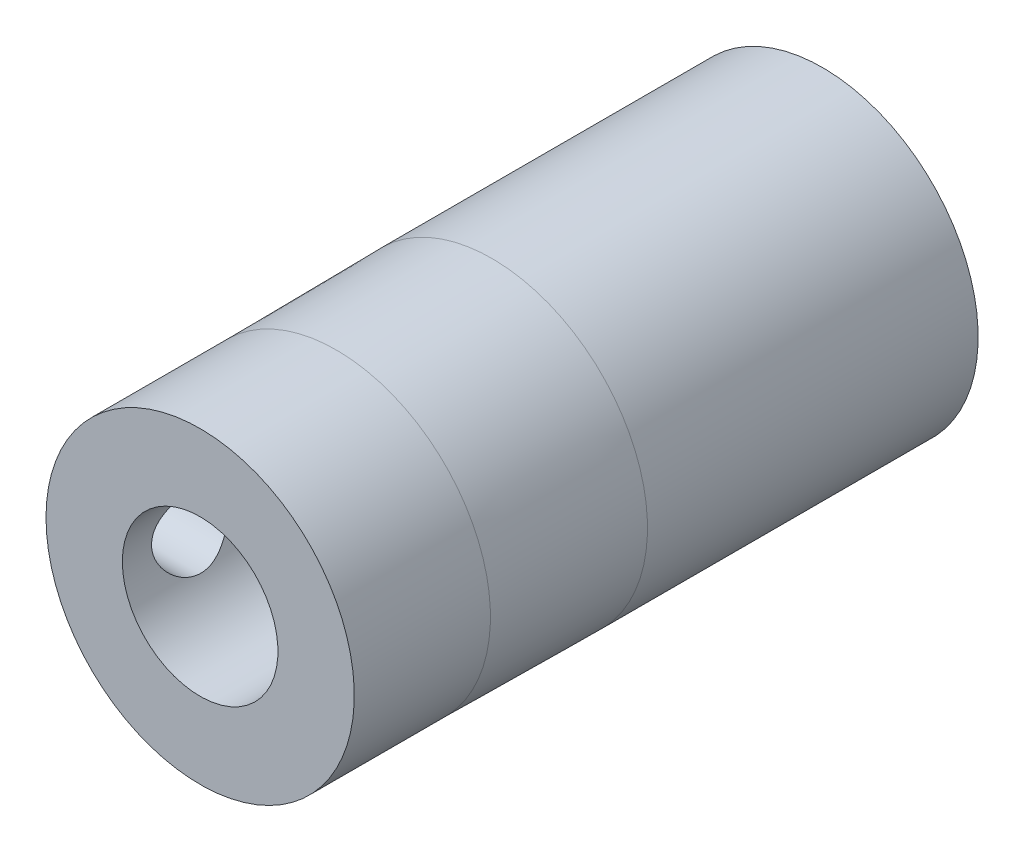
from build123d import *

# Parameters (mm, degrees)
SCHIZZO2_R               = 2
TAGLIO_ESTRUSIONE1_DEPTH = 49.025821347


with BuildPart() as part:
    # Schizzo1 → Rivoluzione1 (revolve)
    with BuildSketch(Plane(origin=(0, 0, 0), x_dir=(1, 0, 0), z_dir=(0, 1, 0)), mode=Mode.PRIVATE) as rivoluzione1_sk:
        Polygon((4, 46.674184686), (8, 46.674184686), (8, 29.674184686), (7.925, 21.674184686), (7.925, 14.674184686), (4, 14.674184686), align=None)
    revolve(rivoluzione1_sk.sketch.rotate(Axis((0, 0, -88.99), (0, 0, 1)), 180), axis=Axis((0, 0, -88.99), (0, 0, 1)))

    # Schizzo2 → Taglio-Estrusione1 (cut, through all)
    with BuildSketch(Plane(origin=(0, 0, 0), x_dir=(0, 0, -1), z_dir=(1, 0, 0))):
        with Locations((18.174184686, 0)):
            Circle(SCHIZZO2_R)
    extrude(amount=-TAGLIO_ESTRUSIONE1_DEPTH, mode=Mode.SUBTRACT)


solid = part.part
